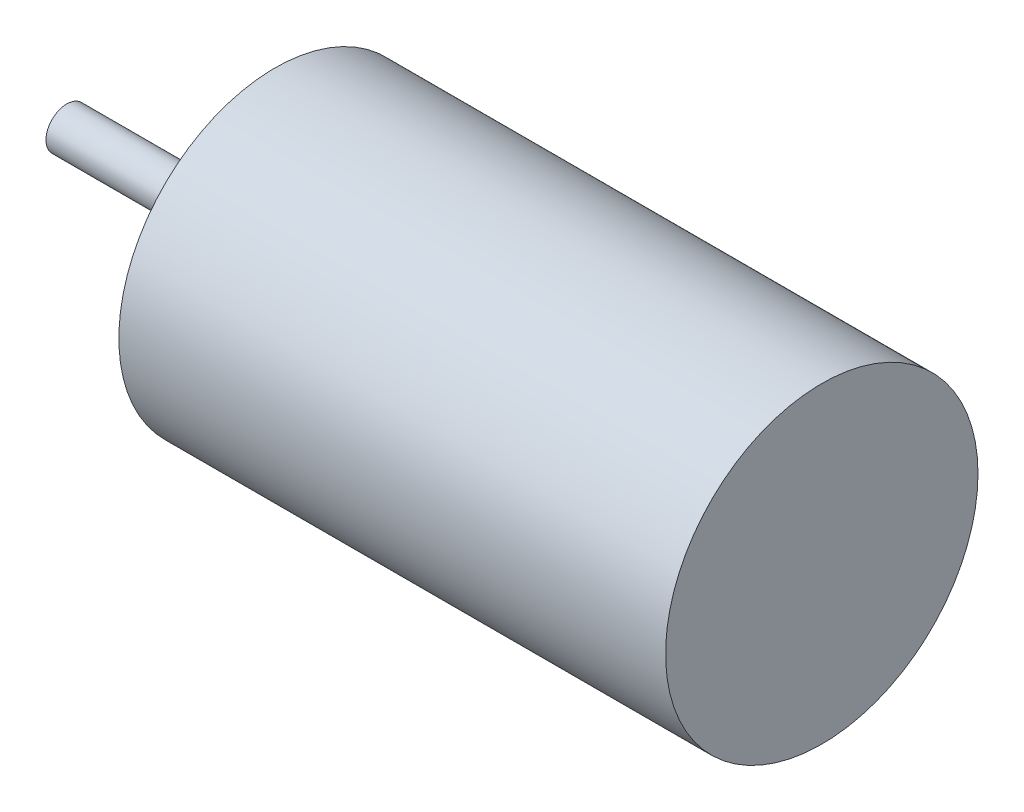
from build123d import *


with BuildPart() as part:
    # Sketch1 → Revolve1 (revolve)
    with BuildSketch(Plane(origin=(0, 0, 0), x_dir=(1, 0, 0), z_dir=(0, 1, 0))):
        Polygon((0, 0), (-14.5, 0), (-14.5, 0.4), (-10.5, 0.4), (-10.5, 3), (0, 3), align=None)
    revolve(axis=Axis((0, 0, 0), (-1, 0, 0)))


solid = part.part
